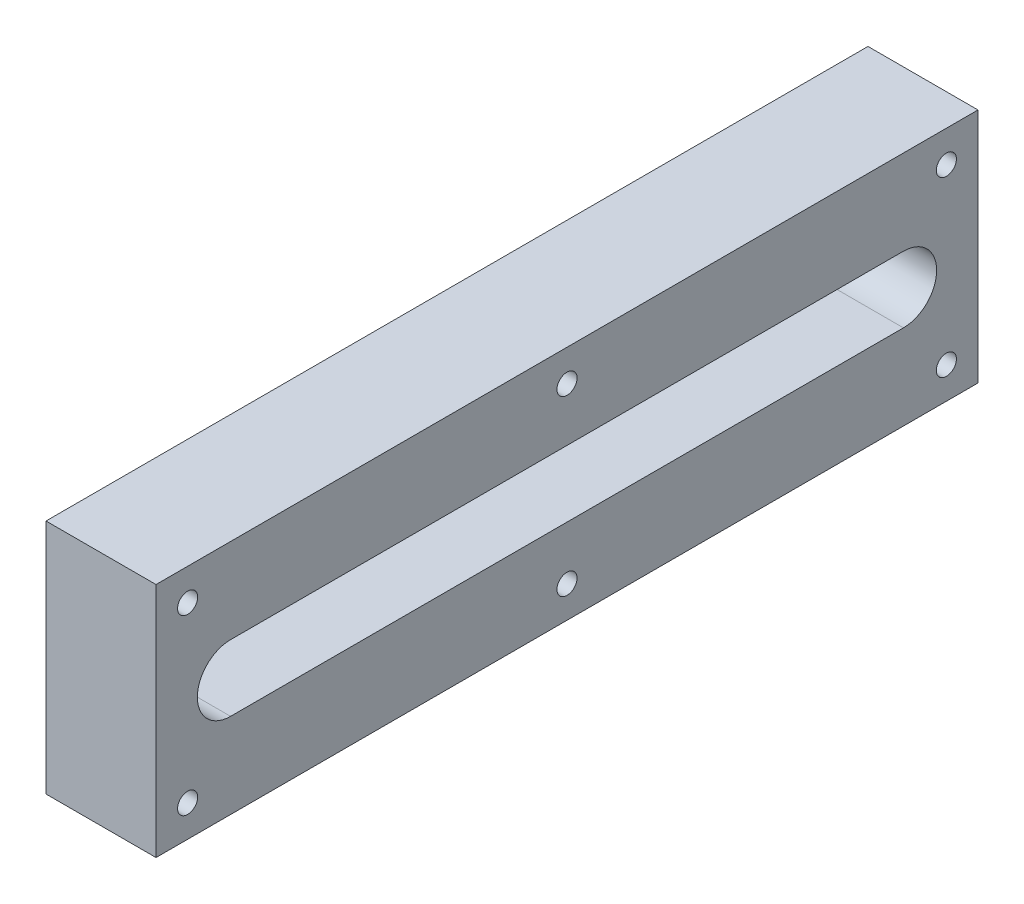
from build123d import *

# Parameters (mm, degrees)
SKETCH1_W              = 165.1
SKETCH1_H              = 47.498
BOSS_EXTRUDE1_DEPTH    = 22.098
F_10_32_TAPPED_HOLE1_D = 4.0386


with BuildPart() as part:
    # Sketch1 → Boss-Extrude1 (new body)
    with BuildSketch(Plane(origin=(0, 0, 0), x_dir=(0, 0, -1), z_dir=(1, 0, 0))):
        Rectangle(SKETCH1_W, SKETCH1_H)
        with BuildLine():
            Line((-67.5752522, 6.6675), (67.5752522, 6.6675))
            ThreePointArc((67.5752522, 6.6675), (74.2427522, 0), (67.5752522, -6.6675))
            Line((67.5752522, -6.6675), (-67.5752522, -6.6675))
            ThreePointArc((-67.5752522, -6.6675), (-74.2427522, 0), (-67.5752522, 6.6675))
        make_face(mode=Mode.SUBTRACT)
    extrude(amount=BOSS_EXTRUDE1_DEPTH)

    # #10-32 Tapped Hole1 (through all)
    with Locations(Plane(origin=(22.098, 0, 0), x_dir=(0, 0, -1), z_dir=(1, 0, 0))):
        with Locations((-76.2, 17.399), (-76.2, -17.399), (0, -17.399), (76.2, -17.399), (76.2, 17.399), (0, 17.399)):
            Hole(F_10_32_TAPPED_HOLE1_D / 2)


solid = part.part
